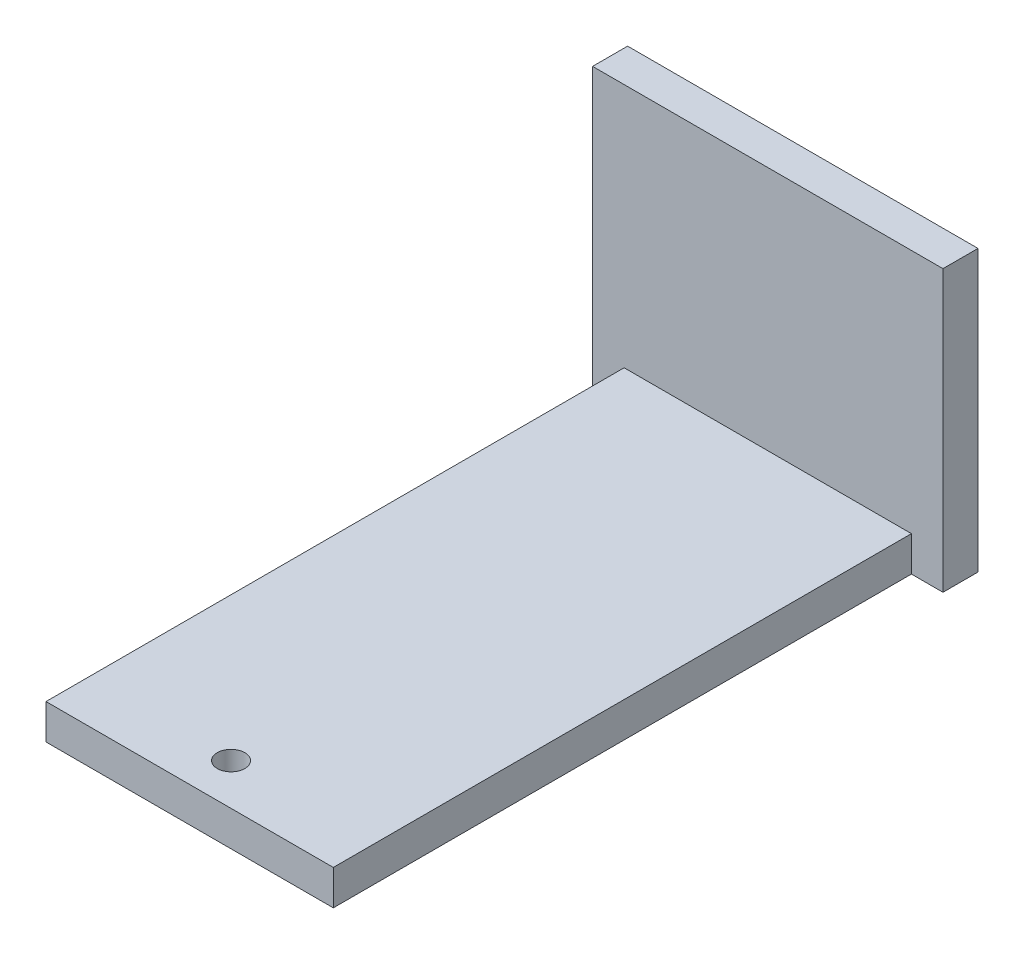
from build123d import *

# Parameters (mm, degrees)
SKETCH1_W           = 25.4
SKETCH1_H           = 25.4
BOSS_EXTRUDE1_DEPTH = 2.54
BOSS_EXTRUDE3_DEPTH = 1.27
SKETCH6_W           = 25.4
SKETCH6_H           = 5.08
CUT_EXTRUDE1_DEPTH  = 58.15
SKETCH7_R           = 1
CUT_EXTRUDE2_DEPTH  = 56.080531043


with BuildPart() as part:
    # Sketch1 → Boss-Extrude1 (new body)
    with BuildSketch(Plane.XY):
        with Locations((12.7, -12.7)):
            Rectangle(SKETCH1_W, SKETCH1_H)
    extrude(amount=BOSS_EXTRUDE1_DEPTH)

    # Sketch2 → Boss-Extrude3 (add, symmetric)
    with BuildSketch(Plane(origin=(0, -19.05, 0), x_dir=(1, 0, 0), z_dir=(0, 1, 0))):
        Polygon((2.286, -44.45), (2.286, -2.54), (12.7, -2.54), (23.114, -2.54), (23.114, -44.45), align=None)
    extrude(amount=BOSS_EXTRUDE3_DEPTH, both=True)

    # Sketch6 → Cut-Extrude1 (cut, through all)
    with BuildSketch(Plane.XY.offset(44.45)):
        with Locations((12.7, -22.86)):
            Rectangle(SKETCH6_W, SKETCH6_H)
    extrude(amount=-CUT_EXTRUDE1_DEPTH, mode=Mode.SUBTRACT)

    # Sketch7 → Cut-Extrude2 (cut, through all)
    with BuildSketch(Plane(origin=(0, -20.32, 0), x_dir=(-1, 0, 0), z_dir=(0, -1, 0))):
        with Locations(Location((-12.7, -41.45, 0), (0, 0, 90))):
            Circle(SKETCH7_R)
    extrude(amount=-CUT_EXTRUDE2_DEPTH, mode=Mode.SUBTRACT)


solid = part.part
